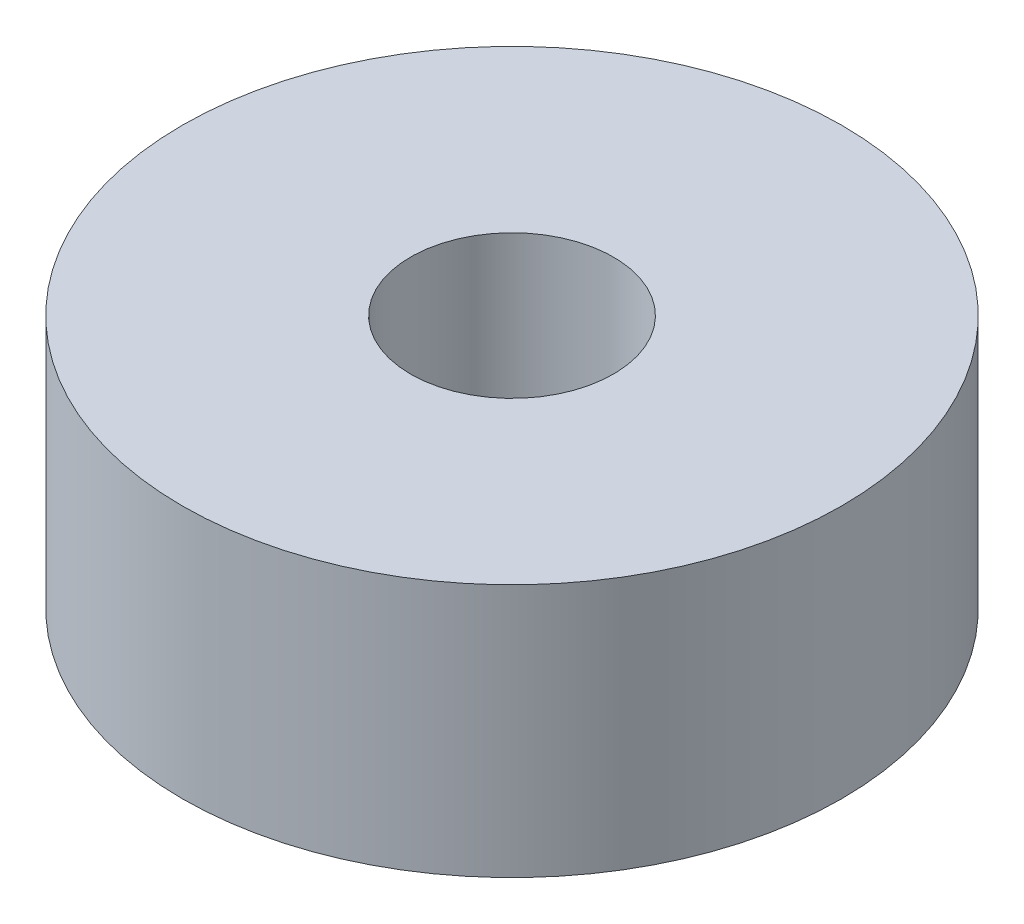
from build123d import *

# Parameters (mm, degrees)
CROQUIS1_R              = 6.5
CROQUIS1_R_2            = 2
SALIENTE_EXTRUIR1_DEPTH = 5


with BuildPart() as part:
    # Croquis1 → Saliente-Extruir1 (new body)
    with BuildSketch(Plane(origin=(0, 0, 0), x_dir=(1, 0, 0), z_dir=(0, 1, 0))):
        with Locations(Location((0, 0, 0), (0, 0, 270))):
            Circle(CROQUIS1_R)
        with Locations(Location((0, 0, 0), (0, 0, 270))):
            Circle(CROQUIS1_R_2, mode=Mode.SUBTRACT)
    extrude(amount=SALIENTE_EXTRUIR1_DEPTH)


solid = part.part
